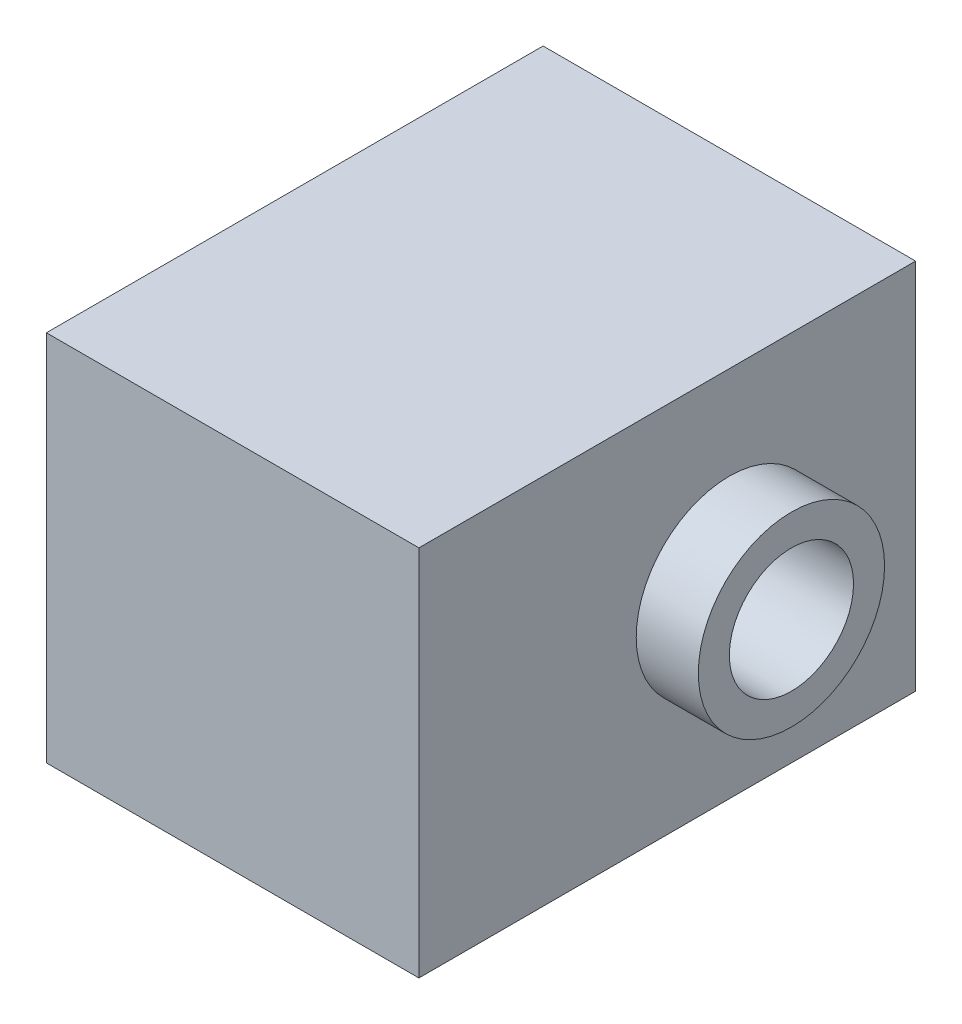
from build123d import *

# Parameters (mm, degrees)
SKETCH_1_W          = 40
SKETCH_1_H          = 30
EXTRUDE_1_DEPTH     = 30
SKETCH_2_R          = 7.5
SKETCH_2_R_2        = 5
EXTRUDE_2_DEPTH     = 5
SKETCH_2_2_R        = 5
CUT_EXTRUDE_1_DEPTH = 40.05124838


with BuildPart() as part:
    # Эскиз1 → Бобышка-Вытянуть1 (new body)
    with BuildSketch(Plane(origin=(0, 0, 0), x_dir=(0, 0, -1), z_dir=(1, 0, 0))):
        Rectangle(SKETCH_1_W, SKETCH_1_H)
    extrude(amount=-EXTRUDE_1_DEPTH)

    # Эскиз2 → Бобышка-Вытянуть2 (add)
    with BuildSketch(Plane(origin=(0, 0, 0), x_dir=(0, 0, -1), z_dir=(1, 0, 0))):
        with Locations((5, 0)):
            Circle(SKETCH_2_R)
        with Locations((5, 0)):
            Circle(SKETCH_2_R_2, mode=Mode.SUBTRACT)
    extrude(amount=EXTRUDE_2_DEPTH)

    # Эскиз2<2> → Вырез-Вытянуть1 (cut, through all)
    with BuildSketch(Plane(origin=(0, 0, 0), x_dir=(0, 0, -1), z_dir=(1, 0, 0))):
        with Locations((5, 0)):
            Circle(SKETCH_2_2_R)
    extrude(amount=-CUT_EXTRUDE_1_DEPTH, mode=Mode.SUBTRACT)


solid = part.part
